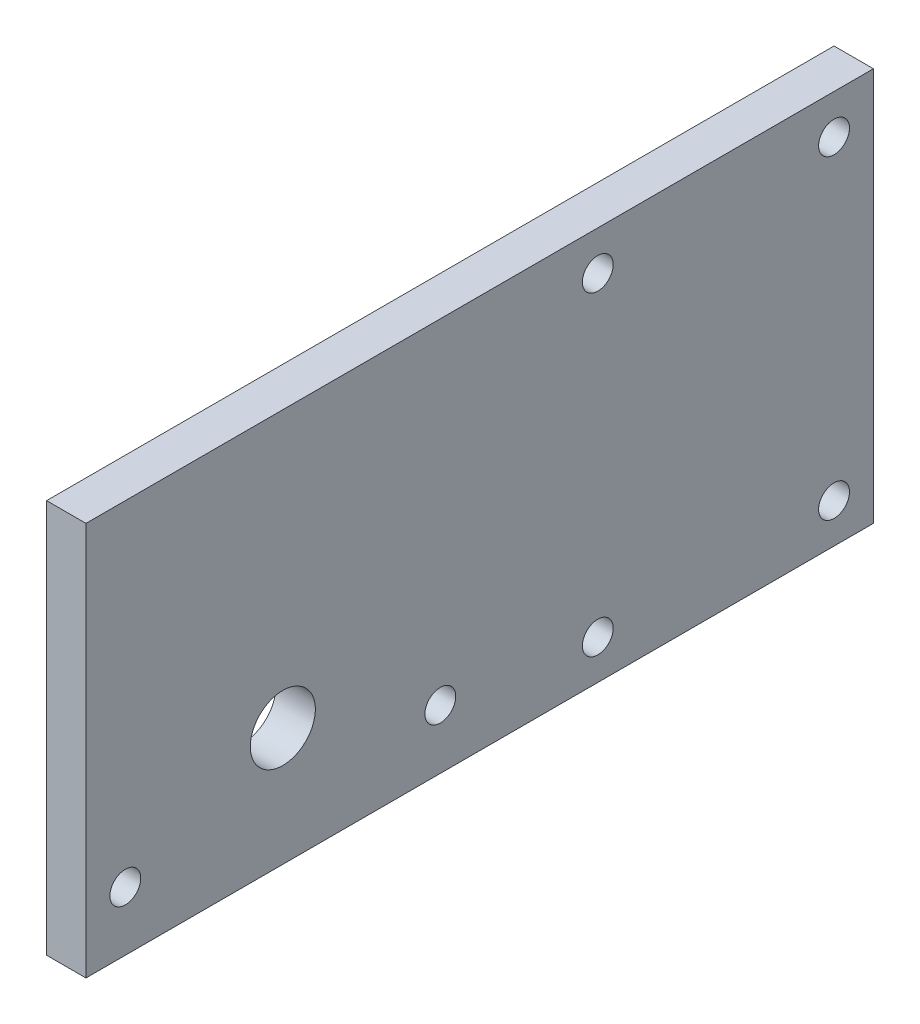
from build123d import *

# Parameters (mm, degrees)
SKETCH1_W                      = 127
SKETCH1_H                      = 63.5
BOSS_EXTRUDE1_DEPTH            = 6.35
F_9_0_196_DIAMETER_HOLE1_D     = 4.9784
F_9_0_196_DIAMETER_HOLE1_DEPTH = 70.104
F_9_0_196_DIAMETER_HOLE1_TIP   = 1.495662253
F_9_0_196_DIAMETER_HOLE2_D     = 4.9784
F_9_0_196_DIAMETER_HOLE2_DEPTH = 70.104
F_9_0_196_DIAMETER_HOLE2_TIP   = 1.495662253
Z_0_413_DIAMETER_HOLE1_D       = 10.4902
Z_0_413_DIAMETER_HOLE1_DEPTH   = 70.104
Z_0_413_DIAMETER_HOLE1_TIP     = 3.151574033


with BuildPart() as part:
    # Sketch1 → Boss-Extrude1 (new body)
    with BuildSketch(Plane(origin=(0, 0, 0), x_dir=(0, 0, -1), z_dir=(1, 0, 0))):
        Rectangle(SKETCH1_W, SKETCH1_H)
    extrude(amount=BOSS_EXTRUDE1_DEPTH)

    # #9 (0.196) Diameter Hole1
    with Locations(Plane.ZY):
        with Locations((57.15, -22.225), (6.35, -22.225)):
            Hole(F_9_0_196_DIAMETER_HOLE1_D / 2, depth=F_9_0_196_DIAMETER_HOLE1_DEPTH)
            with Locations((0, 0, -(F_9_0_196_DIAMETER_HOLE1_DEPTH + F_9_0_196_DIAMETER_HOLE1_TIP / 2))):  # 118° drill point
                Cone(0, F_9_0_196_DIAMETER_HOLE1_D / 2, F_9_0_196_DIAMETER_HOLE1_TIP, mode=Mode.SUBTRACT)

    # #9 (0.196) Diameter Hole2
    with Locations(Plane.ZY):
        with Locations((-57.15, -25.4), (-19.05, -25.4), (-19.05, 25.4), (-57.15, 25.4)):
            Hole(F_9_0_196_DIAMETER_HOLE2_D / 2, depth=F_9_0_196_DIAMETER_HOLE2_DEPTH)
            with Locations((0, 0, -(F_9_0_196_DIAMETER_HOLE2_DEPTH + F_9_0_196_DIAMETER_HOLE2_TIP / 2))):  # 118° drill point
                Cone(0, F_9_0_196_DIAMETER_HOLE2_D / 2, F_9_0_196_DIAMETER_HOLE2_TIP, mode=Mode.SUBTRACT)

    # Z (0.413) Diameter Hole1
    with Locations(Plane.ZY):
        with Locations((31.75, -12.7)):
            Hole(Z_0_413_DIAMETER_HOLE1_D / 2, depth=Z_0_413_DIAMETER_HOLE1_DEPTH)
            with Locations((0, 0, -(Z_0_413_DIAMETER_HOLE1_DEPTH + Z_0_413_DIAMETER_HOLE1_TIP / 2))):  # 118° drill point
                Cone(0, Z_0_413_DIAMETER_HOLE1_D / 2, Z_0_413_DIAMETER_HOLE1_TIP, mode=Mode.SUBTRACT)


solid = part.part
